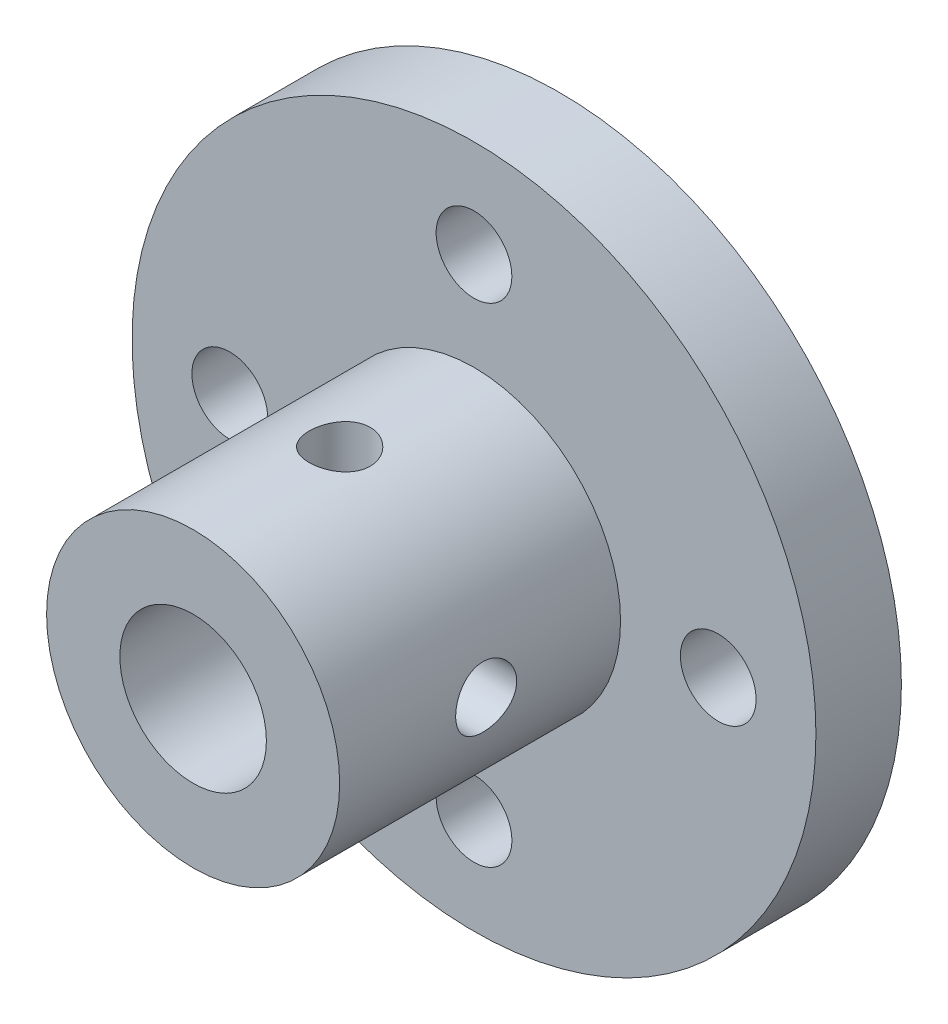
from build123d import *

# Parameters (mm, degrees)
SKETCH_1_R               = 14
EXTRUDE_1_DEPTH          = 3.5
SKETCH_2_R               = 6
EXTRUDE_2_DEPTH          = 11.5
SKETCH_3_R               = 3
CUT_EXTRUDE_1_DEPTH      = 25.839484697
SKETCH_4_R               = 1.55
CUT_EXTRUDE_2_DEPTH      = 23.896506284
PATTERN_CIRCULAR_1_COUNT = 4
PATTERN_CIRCULAR_2_COUNT = 2
PATTERN_CIRCULAR_2_ANGLE = 90


with BuildPart() as part:
    # 草图1 → 凸台-拉伸1 (new body)
    with BuildSketch(Plane.XY):
        Circle(SKETCH_1_R)
    extrude(amount=EXTRUDE_1_DEPTH)

    # 草图2 → 凸台-拉伸2 (add)
    with BuildSketch(Plane.XY.offset(3.5)):
        Circle(SKETCH_2_R)
    extrude(amount=EXTRUDE_2_DEPTH)

    # 草图3 → 切除-拉伸1 (cut, through all)
    with BuildSketch(Plane.XY.offset(15)):
        Circle(SKETCH_3_R)
    extrude(amount=-CUT_EXTRUDE_1_DEPTH, mode=Mode.SUBTRACT)

    # 草图4 → 切除-拉伸2 (cut, through all)
    with BuildSketch(Plane.XY.offset(3.5)):
        with Locations((0, 10)):
            Circle(SKETCH_4_R)
    cut_extrude_2 = extrude(amount=-CUT_EXTRUDE_2_DEPTH, mode=Mode.SUBTRACT)

    # 阵列(圆周)1: 切除-拉伸2 ×4 about axis
    pattern_circular_1_axis = Axis((0, 0, 0), (0, 0, 1))
    for i in range(1, PATTERN_CIRCULAR_1_COUNT):
        add(cut_extrude_2.rotate(pattern_circular_1_axis, i * 360 / PATTERN_CIRCULAR_1_COUNT), mode=Mode.SUBTRACT)

    # 草图6 → M3 螺纹孔1 (revolve, cut)
    with BuildSketch(Plane(origin=(0, 0, 9), x_dir=(0, 0, 1), z_dir=(0, 1, 0))):
        Polygon((0, 0), (0, 8.251075774), (1.25, 7.5), (1.25, 0.275), (1.525, 0), align=None)
    hole_wizard_m3_1 = revolve(axis=Axis((-6.35, 0, 9), (1, 0, 0)), mode=Mode.SUBTRACT)

    # 阵列(圆周)2: M3 螺纹孔1 ×2 about axis
    pattern_circular_2_axis = Axis((0, 0, 15), (0, 0, 1))
    for i in range(1, PATTERN_CIRCULAR_2_COUNT):
        add(hole_wizard_m3_1.rotate(pattern_circular_2_axis, i * PATTERN_CIRCULAR_2_ANGLE / (PATTERN_CIRCULAR_2_COUNT - 1)), mode=Mode.SUBTRACT)


solid = part.part
